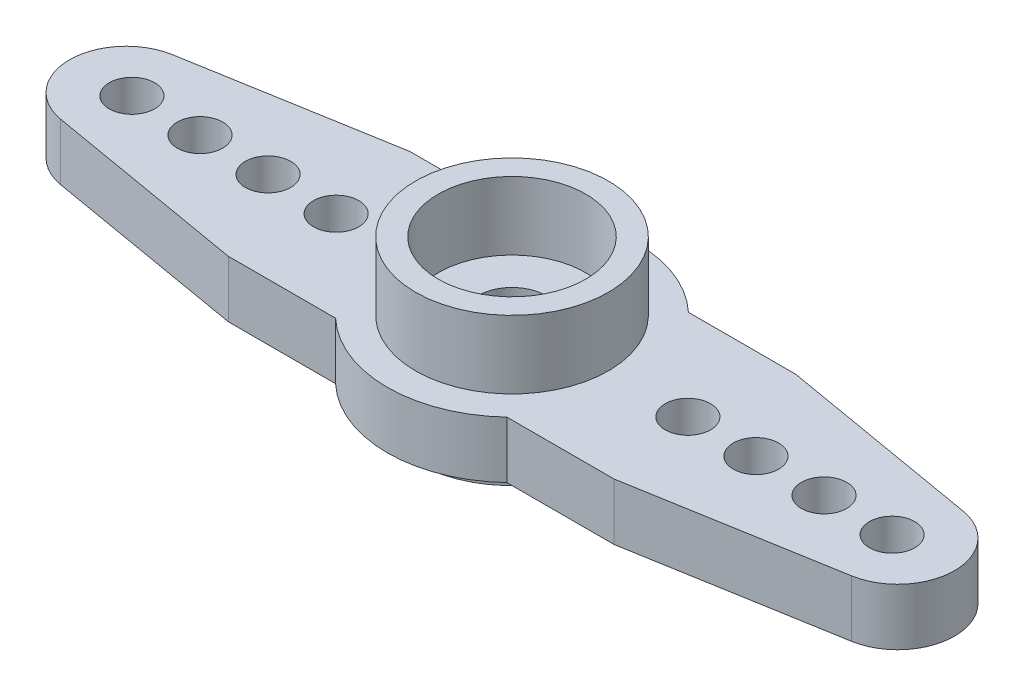
from build123d import *

# Parameters (mm, degrees)
SKETCH1_R                = 1
SKETCH1_R_2              = 1.5
BOSS_EXTRUDE1_DEPTH      = 1.25
BOSS_EXTRUDE2_DEPTH      = 3
BOSS_EXTRUDE2_DEPTH_BACK = 3.5
BOSS_EXTRUDE2_START      = 1.25
SKETCH3_R                = 4.25
SKETCH3_R_2              = 3.25


with BuildPart() as part:
    # Sketch1 → Boss-Extrude1 (new, symmetric)
    # profile 1 of 3: a face of its own
    with BuildSketch(Plane(origin=(0, 0, 0), x_dir=(1, 0, 0), z_dir=(0, 1, 0))):
        with BuildLine():
            ThreePointArc((17.424122962, 2.463761294), (19.5, 0), (17.424122962, -2.463761294))
            Line((17.424122962, -2.463761294), (8.5, -4))
            Line((8.5, -4), (-8.5, -4))
            Line((-8.5, -4), (-17.424122962, -2.463761294))
            ThreePointArc((-17.424122962, -2.463761294), (-19.5, 0), (-17.424122962, 2.463761294))
            Line((-17.424122962, 2.463761294), (-8.5, 4))
            Line((-8.5, 4), (8.5, 4))
            Line((8.5, 4), (17.424122962, 2.463761294))
        make_face()
        with Locations(Location((-7.75, 0, 0), (0, 0, 270))):
            Circle(SKETCH1_R, mode=Mode.SUBTRACT)
        with Locations(Location((-16.75, 0, 0), (0, 0, 270))):
            Circle(SKETCH1_R, mode=Mode.SUBTRACT)
        with Locations(Location((16.75, 0, 0), (0, 0, 270))):
            Circle(SKETCH1_R, mode=Mode.SUBTRACT)
        with Locations(Location((13.75, 0, 0), (0, 0, 270))):
            Circle(SKETCH1_R, mode=Mode.SUBTRACT)
        with Locations(Location((10.75, 0, 0), (0, 0, 270))):
            Circle(SKETCH1_R, mode=Mode.SUBTRACT)
        with Locations(Location((7.75, 0, 0), (0, 0, 270))):
            Circle(SKETCH1_R, mode=Mode.SUBTRACT)
        with Locations(Location((0, 0, 0), (0, 0, 270))):
            Circle(SKETCH1_R_2, mode=Mode.SUBTRACT)
        with Locations(Location((-13.75, 0, 0), (0, 0, 270))):
            Circle(SKETCH1_R, mode=Mode.SUBTRACT)
        with Locations(Location((-10.75, 0, 0), (0, 0, 270))):
            Circle(SKETCH1_R, mode=Mode.SUBTRACT)
    # profile 2 of 3: a face of its own
    with BuildSketch(Plane(origin=(0, 0, 0), x_dir=(1, 0, 0), z_dir=(0, 1, 0))):
        with BuildLine():
            ThreePointArc((3.774917218, 4), (0, 5.5), (-3.774917218, 4))
            Line((-3.774917218, 4), (3.774917218, 4))
        make_face()
    # profile 3 of 3: a face of its own
    with BuildSketch(Plane(origin=(0, 0, 0), x_dir=(1, 0, 0), z_dir=(0, 1, 0))):
        with BuildLine():
            Line((3.774917218, -4), (-3.774917218, -4))
            ThreePointArc((-3.774917218, -4), (0, -5.5), (3.774917218, -4))
        make_face()
    extrude(amount=BOSS_EXTRUDE1_DEPTH, both=True)

    # Sketch3 → Boss-Extrude2 (add, two sides: drawn at the far end of the back side and taken through both)
    with BuildSketch(Plane(origin=(0, 0, 0), x_dir=(1, 0, 0), z_dir=(0, 1, 0)).offset(BOSS_EXTRUDE2_START - BOSS_EXTRUDE2_DEPTH_BACK)):
        with Locations(Location((0, 0, 0), (0, 0, 270))):
            Circle(SKETCH3_R)
        with Locations(Location((0, 0, 0), (0, 0, 270))):
            Circle(SKETCH3_R_2, mode=Mode.SUBTRACT)
    extrude(amount=BOSS_EXTRUDE2_DEPTH + BOSS_EXTRUDE2_DEPTH_BACK)


solid = part.part
